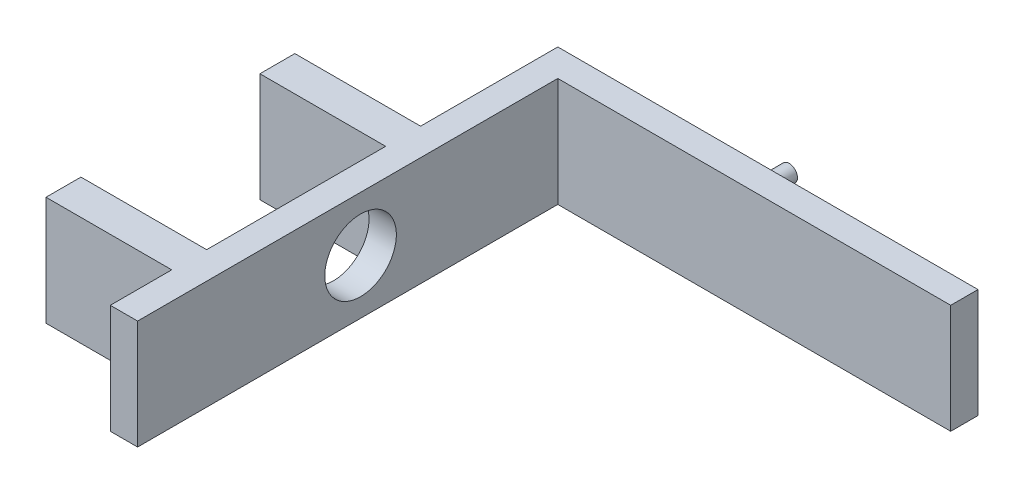
from build123d import *

# Parameters (mm, degrees)
BOSS_EXTRUDE1_DEPTH = 7.9375
SKETCH3_R           = 5.207
CUT_EXTRUDE1_DEPTH  = 3.96875
SKETCH4_R           = 1.2065
BOSS_EXTRUDE2_DEPTH = 8.89
SKETCH5_W           = 5.08
SKETCH5_H           = 15.875
BOSS_EXTRUDE3_DEPTH = 18.288


with BuildPart() as part:
    # Sketch1 → Boss-Extrude1 (new, symmetric)
    with BuildSketch(Plane(origin=(0, 0, 0), x_dir=(1, 0, 0), z_dir=(0, 1, 0))):
        Polygon((-2.757708096, -19.86108723), (1.211041904, -19.86108723), (1.211041904, 41.25766277), (58.361041904, 41.25766277), (58.361041904, 45.22641277), (6.27967861, 45.22641277), (-2.757708096, 45.22641277), align=None)
    extrude(amount=BOSS_EXTRUDE1_DEPTH, both=True)

    # Sketch3 → Cut-Extrude1 (cut)
    with BuildSketch(Plane.ZY.offset(2.757708096)):
        with Locations((-12.566559842, 0)):
            Circle(SKETCH3_R)
    extrude(amount=-CUT_EXTRUDE1_DEPTH, mode=Mode.SUBTRACT)

    # Sketch4 → Boss-Extrude2 (add)
    with BuildSketch(Plane(origin=(0, 0, -45.22641277), x_dir=(-1, 0, 0), z_dir=(0, 0, -1))):
        with Locations(Location((-22.007291904, 0, 0), (0, 0, 180))):
            Circle(SKETCH4_R)
    extrude(amount=BOSS_EXTRUDE2_DEPTH)

    # Sketch5 → Boss-Extrude3 (add)
    with BuildSketch(Plane.ZY.offset(2.757708096)):
        with Locations((-22.726559842, 0)):
            Rectangle(SKETCH5_W, SKETCH5_H)
        with Locations((8.388440158, 0)):
            Rectangle(SKETCH5_W, SKETCH5_H)
    extrude(amount=BOSS_EXTRUDE3_DEPTH)


solid = part.part
